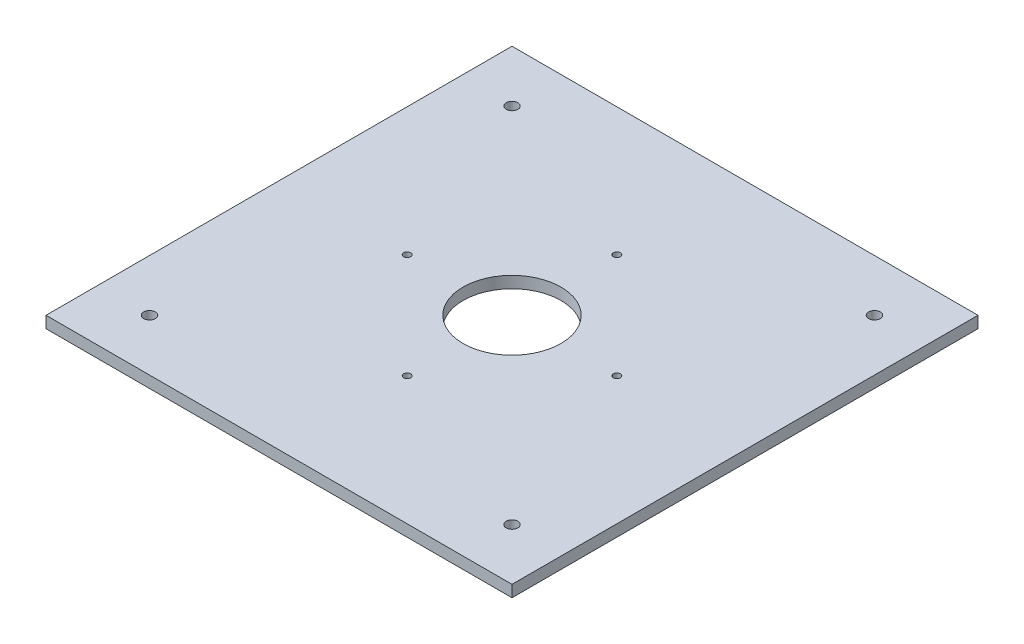
from build123d import *

# Parameters (mm, degrees)
SKETCH1_W           = 200
SKETCH1_H           = 200
BOSS_EXTRUDE1_DEPTH = 5
SKETCH2_R           = 2.5
CUT_EXTRUDE1_DEPTH  = 5
SKETCH3_R           = 1.5
CUT_EXTRUDE2_DEPTH  = 5
SKETCH4_R           = 21
CUT_EXTRUDE3_DEPTH  = 7


with BuildPart() as part:
    # Sketch1 → Boss-Extrude1 (new body)
    with BuildSketch(Plane(origin=(0, 0, 0), x_dir=(1, 0, 0), z_dir=(0, 1, 0))):
        Rectangle(SKETCH1_W, SKETCH1_H)
    extrude(amount=BOSS_EXTRUDE1_DEPTH)

    # Sketch2 → Cut-Extrude1 (cut)
    with BuildSketch(Plane(origin=(0, 5, 0), x_dir=(1, 0, 0), z_dir=(0, 1, 0))):
        with Locations(Location((77.781745931, 77.781745931, 0), (0, 0, 270))):
            Circle(SKETCH2_R)
        with Locations(Location((77.781745931, -77.781745931, 0), (0, 0, 270))):
            Circle(SKETCH2_R)
        with Locations(Location((-77.781745931, -77.781745931, 0), (0, 0, 270))):
            Circle(SKETCH2_R)
        with Locations(Location((-77.781745931, 77.781745931, 0), (0, 0, 270))):
            Circle(SKETCH2_R)
    extrude(amount=-CUT_EXTRUDE1_DEPTH, mode=Mode.SUBTRACT)

    # Sketch3 → Cut-Extrude2 (cut)
    with BuildSketch(Plane(origin=(0, 5, 0), x_dir=(1, 0, 0), z_dir=(0, 1, 0))):
        with Locations(Location((0, -45, 0), (0, 0, 270))):
            Circle(SKETCH3_R)
        with Locations(Location((-45, 0, 0), (0, 0, 270))):
            Circle(SKETCH3_R)
        with Locations(Location((0, 45, 0), (0, 0, 270))):
            Circle(SKETCH3_R)
        with Locations(Location((45, 0, 0), (0, 0, 270))):
            Circle(SKETCH3_R)
    extrude(amount=-CUT_EXTRUDE2_DEPTH, mode=Mode.SUBTRACT)

    # Sketch4 → Cut-Extrude3 (cut)
    with BuildSketch(Plane(origin=(0, 5, 0), x_dir=(1, 0, 0), z_dir=(0, 1, 0))):
        with Locations(Location((0, 0, 0), (0, 0, 270))):
            Circle(SKETCH4_R)
    extrude(amount=-CUT_EXTRUDE3_DEPTH, mode=Mode.SUBTRACT)


solid = part.part
